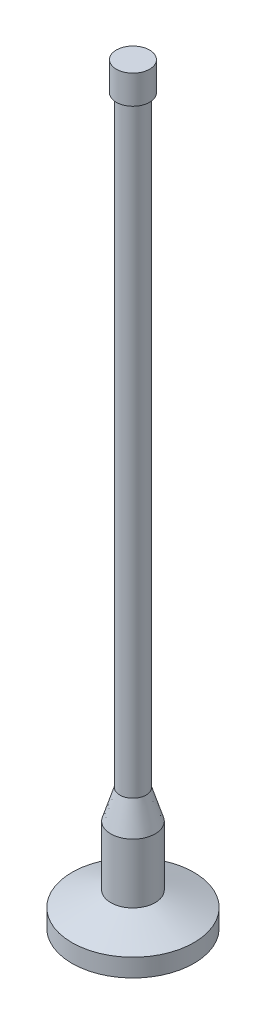
from build123d import *


with BuildPart() as part:
    # Sketch1 → Revolve1 (revolve)
    with BuildSketch(Plane.XY, mode=Mode.PRIVATE) as revolve1_sk:
        Polygon((0, 0), (44, 0), (44, 13), (16, 24), (16, 67), (9.5, 88), (9.5, 522.2875), (12, 522.2875), (12, 543), (0, 543), align=None)
    revolve(revolve1_sk.sketch.rotate(Axis((0, 289.396314171, 0), (0, -1, 0)), 90), axis=Axis((0, 289.396314171, 0), (0, -1, 0)))


solid = part.part
